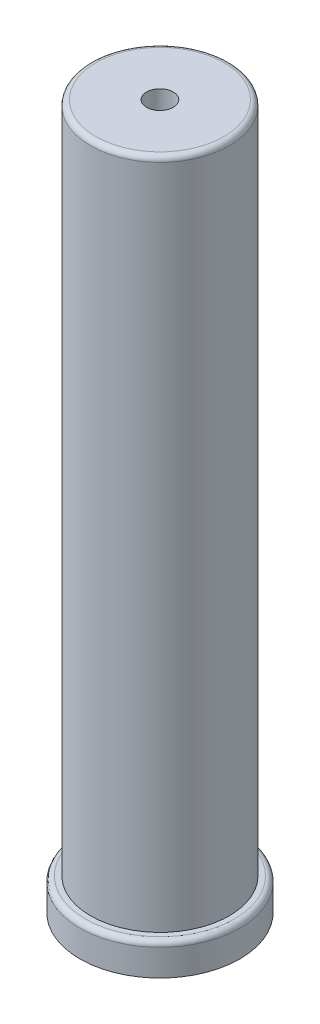
from build123d import *

# Parameters (mm, degrees)
SKETCH_1_R          = 7.5
SKETCH_1_R_2        = 1.25
EXTRUDE_1_DEPTH     = 3
SKETCH_2_R          = 6.5
EXTRUDE_2_DEPTH     = 63
SKETCH_3_R          = 1.25
CUT_EXTRUDE_1_DEPTH = 64.886618317
FILLET_1_R          = 0.5


with BuildPart() as part:
    # Эскиз1 → Бобышка-Вытянуть1 (new body)
    with BuildSketch(Plane(origin=(0, 0, 0), x_dir=(1, 0, 0), z_dir=(0, 1, 0))):
        with Locations(Location((0, 0, 0), (0, 0, 270))):
            Circle(SKETCH_1_R)
        with Locations(Location((0, 0, 0), (0, 0, 270))):
            Circle(SKETCH_1_R_2, mode=Mode.SUBTRACT)
    extrude(amount=EXTRUDE_1_DEPTH)

    # Эскиз2 → Бобышка-Вытянуть2 (add)
    with BuildSketch(Plane(origin=(0, 3, 0), x_dir=(1, 0, 0), z_dir=(0, 1, 0))):
        with Locations(Location((0, 0, 0), (0, 0, 270))):
            Circle(SKETCH_2_R)
    extrude(amount=EXTRUDE_2_DEPTH)

    # Эскиз3 → Вырез-Вытянуть1 (cut, through all)
    with BuildSketch(Plane.XZ.offset(-3)):
        with Locations(Location((0, 0, 0), (0, 0, 270))):
            Circle(SKETCH_3_R)
    extrude(amount=-CUT_EXTRUDE_1_DEPTH, mode=Mode.SUBTRACT)

    # Скругление1
    fillet_1_edges = [part.edges().sort_by_distance(p)[0] for p in [
        (0, 66, -6.5),
        (0, 3, -7.5),
    ]]
    fillet(fillet_1_edges, radius=FILLET_1_R)


solid = part.part
